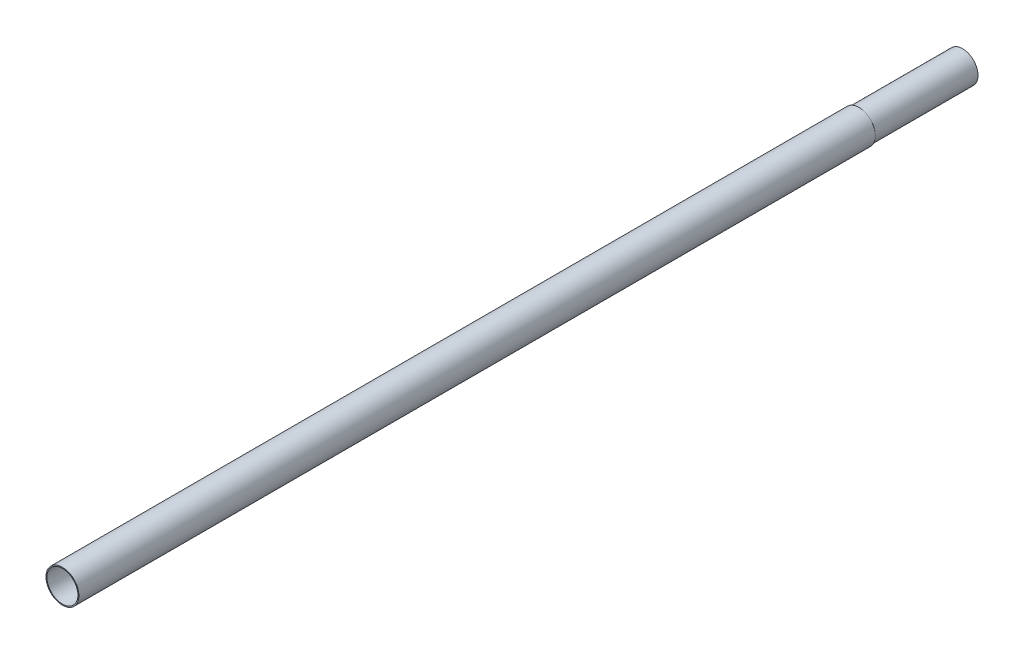
from build123d import *

# Parameters (mm, degrees)
SKETCH1_R           = 25.4
SKETCH1_R_2         = 23.9
BOSS_EXTRUDE1_DEPTH = 1230
SKETCH2_R           = 23.9
SKETCH2_R_2         = 22.4
BOSS_EXTRUDE2_DEPTH = 160


with BuildPart() as part:
    # Sketch1 → Boss-Extrude1 (new body)
    with BuildSketch(Plane.XY):
        Circle(SKETCH1_R)
        Circle(SKETCH1_R_2, mode=Mode.SUBTRACT)
    extrude(amount=BOSS_EXTRUDE1_DEPTH)


with BuildPart() as body_2:
    # Sketch2 → Boss-Extrude2 (new body)
    with BuildSketch(Plane(origin=(0, 0, -160), x_dir=(-1, 0, 0), z_dir=(0, 0, -1))):
        Circle(SKETCH2_R)
        Circle(SKETCH2_R_2, mode=Mode.SUBTRACT)
    extrude(amount=-BOSS_EXTRUDE2_DEPTH)


solid = Compound([part.part, body_2.part])
